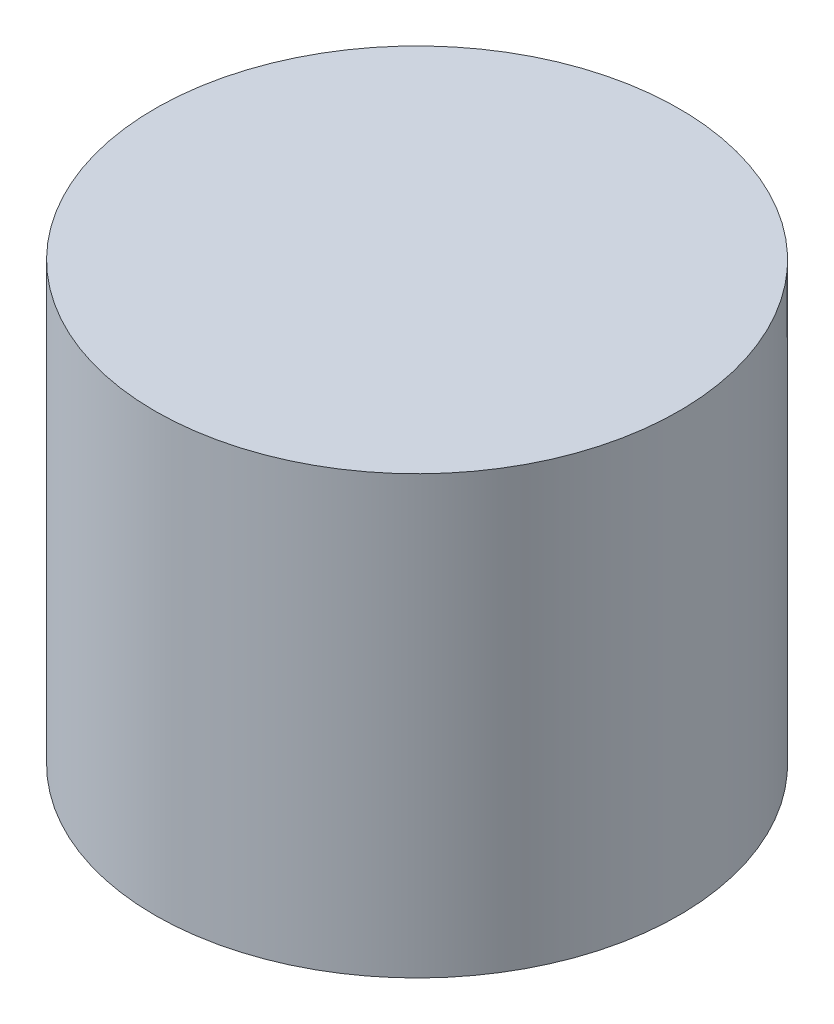
from build123d import *

# Parameters (mm, degrees)
SKETCH_1_R      = 1.5
EXTRUDE_1_DEPTH = 2.5


with BuildPart() as part:
    # 草图1 → 凸台-拉伸1 (new body)
    with BuildSketch(Plane(origin=(0, 0, 0), x_dir=(1, 0, 0), z_dir=(0, 1, 0))):
        with Locations(Location((-9.080137799, 8.353726775, 0), (0, 0, 270))):
            Circle(SKETCH_1_R)
    extrude(amount=EXTRUDE_1_DEPTH)


solid = part.part
